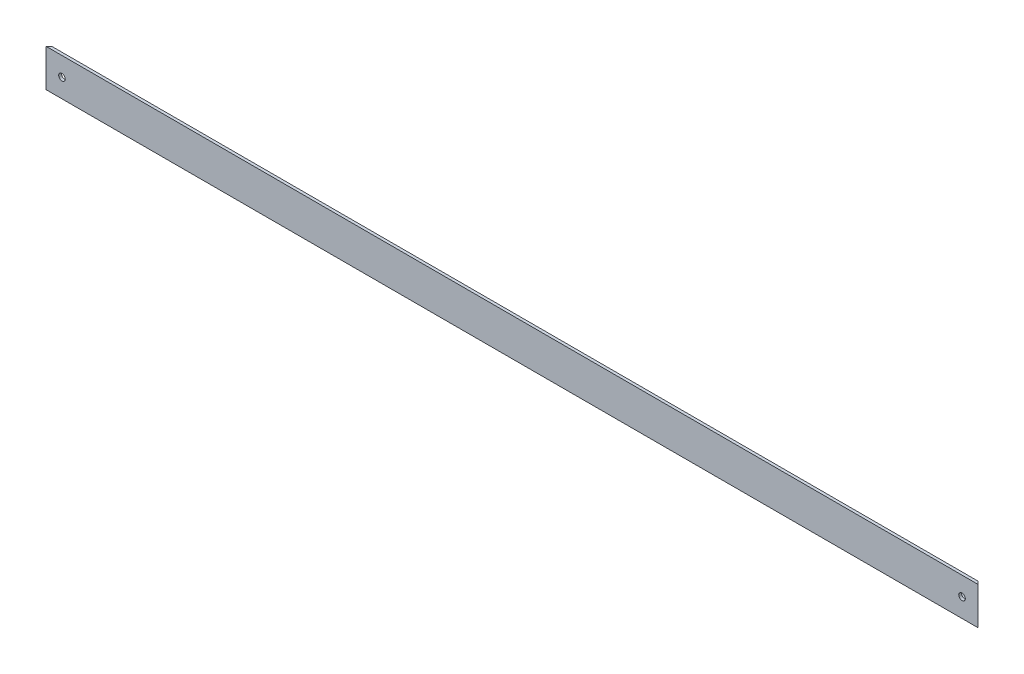
from build123d import *

# Parameters (mm, degrees)
EXTRUDE_1_DEPTH     = 496
CUT_EXTRUDE_1_DEPTH = 497.805797068
CUT_EXTRUDE_2_REACH = 498.806
SKETCH_3_R          = 1.75


with BuildPart() as part:
    # Эскиз1 → Бобышка-Вытянуть1 (new body)
    with BuildSketch(Plane(origin=(0, 0, 0), x_dir=(0, 0, -1), z_dir=(1, 0, 0))):
        Polygon((0, 0), (20, 0), (20, 1.5), (1.5, 1.5), (1.5, 20), (0, 20), align=None)
    extrude(amount=EXTRUDE_1_DEPTH)

    # Эскиз2 → Вырез-Вытянуть1 (cut, through all)
    with BuildSketch(Plane.XZ):
        Polygon((0, 0), (0, -20), (20, -20), align=None)
    cut_extrude_1 = extrude(amount=-CUT_EXTRUDE_1_DEPTH, mode=Mode.SUBTRACT)

    # Эскиз3 → Вырез-Вытянуть2 (cut, up to next)
    with BuildSketch(Plane.XY, mode=Mode.PRIVATE) as cut_extrude_2_sk1:
        with Locations((8.5, 10)):
            Circle(SKETCH_3_R)
    cut_extrude_2_tool1 = extrude(cut_extrude_2_sk1.sketch, amount=-CUT_EXTRUDE_2_REACH, mode=Mode.PRIVATE) & part.part
    cut_extrude_2 = cut_extrude_2_tool1.solids().sort_by_distance((8.5, 10, 0))[0]
    add(cut_extrude_2, mode=Mode.SUBTRACT)

    # Зеркальное отражение1: Вырез-Вытянуть1, Вырез-Вытянуть2 across plane
    add(cut_extrude_1.mirror(Plane(origin=(248, 0, 0), x_dir=(0, 0, 1), z_dir=(1, 0, 0))), mode=Mode.SUBTRACT)
    add(cut_extrude_2.mirror(Plane(origin=(248, 0, 0), x_dir=(0, 0, 1), z_dir=(1, 0, 0))), mode=Mode.SUBTRACT)


solid = part.part
